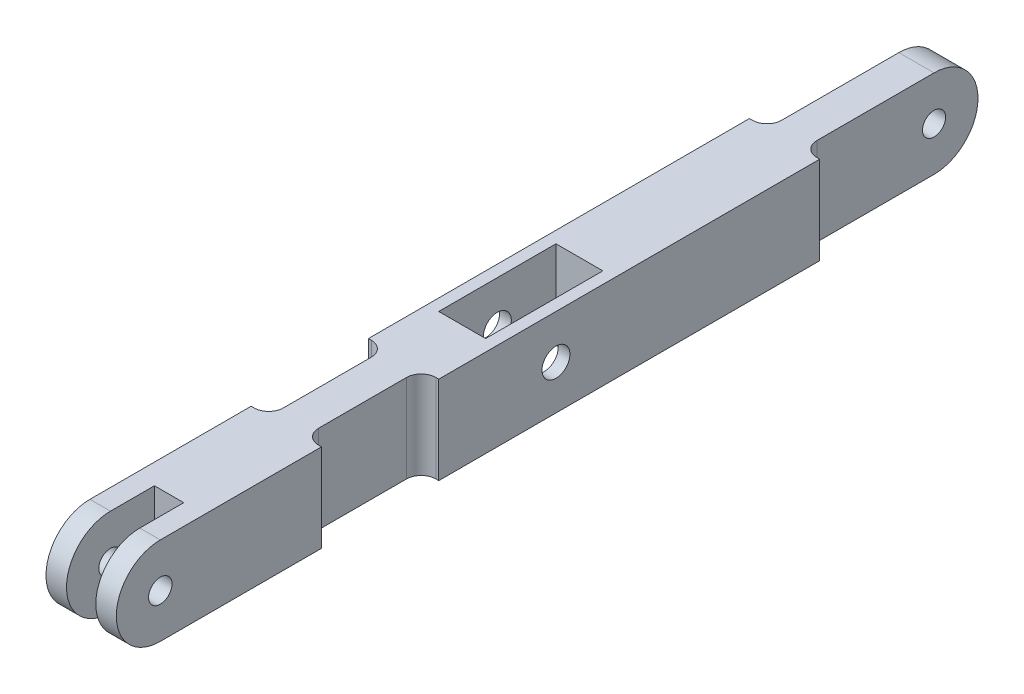
from build123d import *

# Parameters (mm, degrees)
SKETCH1_R           = 2
SKETCH1_R_2         = 2.38125
SKETCH1_R_3         = 1.97
BASE_DEPTH          = 6
ALL_CUTS_DEPTH      = 76.612498967
ALL_CUTS_DEPTH_BACK = 76.612498967
SKETCH2_W           = 5
SKETCH2_H           = 30
SKETCH2_W_2         = 6
SKETCH2_H_2         = 20
SKETCH2_W_3         = 8
FILLET1_R           = 2.5


with BuildPart() as part:
    # Sketch1 → BASE (new, symmetric)
    with BuildSketch(Plane(origin=(0, 0, 0), x_dir=(0, 0, -1), z_dir=(1, 0, 0))):
        with BuildLine():
            Line((-67.5, 7.5), (67.5, 7.5))
            ThreePointArc((67.5, 7.5), (75, 0), (67.5, -7.5))
            Line((67.5, -7.5), (-67.5, -7.5))
            ThreePointArc((-67.5, -7.5), (-75, 0), (-67.5, 7.5))
        make_face()
        with Locations((-67.5, 0)):
            Circle(SKETCH1_R, mode=Mode.SUBTRACT)
        Circle(SKETCH1_R_2, mode=Mode.SUBTRACT)
        with Locations((67.5, 0)):
            Circle(SKETCH1_R_3, mode=Mode.SUBTRACT)
    extrude(amount=BASE_DEPTH, both=True)

    # Sketch2 → All_Cuts (cut, two sides: drawn at the far end of the back side and taken through both)
    with BuildSketch(Plane(origin=(0, 0, 0), x_dir=(1, 0, 0), z_dir=(0, 1, 0)).offset(-ALL_CUTS_DEPTH_BACK)):
        with Locations((0, -75)):
            Rectangle(SKETCH2_W, SKETCH2_H)
        with Locations((-6, -30)):
            Rectangle(SKETCH2_W_2, SKETCH2_H_2)
        with Locations((6, -30)):
            Rectangle(SKETCH2_W_2, SKETCH2_H_2)
        with Locations((6, 60)):
            Rectangle(SKETCH2_W_2, SKETCH2_H)
        with Locations((-6, 60)):
            Rectangle(SKETCH2_W_2, SKETCH2_H)
        Rectangle(SKETCH2_W_3, SKETCH2_H_2)
    extrude(amount=ALL_CUTS_DEPTH + ALL_CUTS_DEPTH_BACK, mode=Mode.SUBTRACT)

    # Fillet1
    fillet1_edges = [part.edges().sort_by_distance(p)[0] for p in [
        (3, 0, 20),
        (3, 0, 40),
        (-3, 0, 40),
        (-3, 0, 20),
        (3, 0, -45),
        (-3, 0, -45),
    ]]
    fillet(fillet1_edges, radius=FILLET1_R)


solid = part.part
